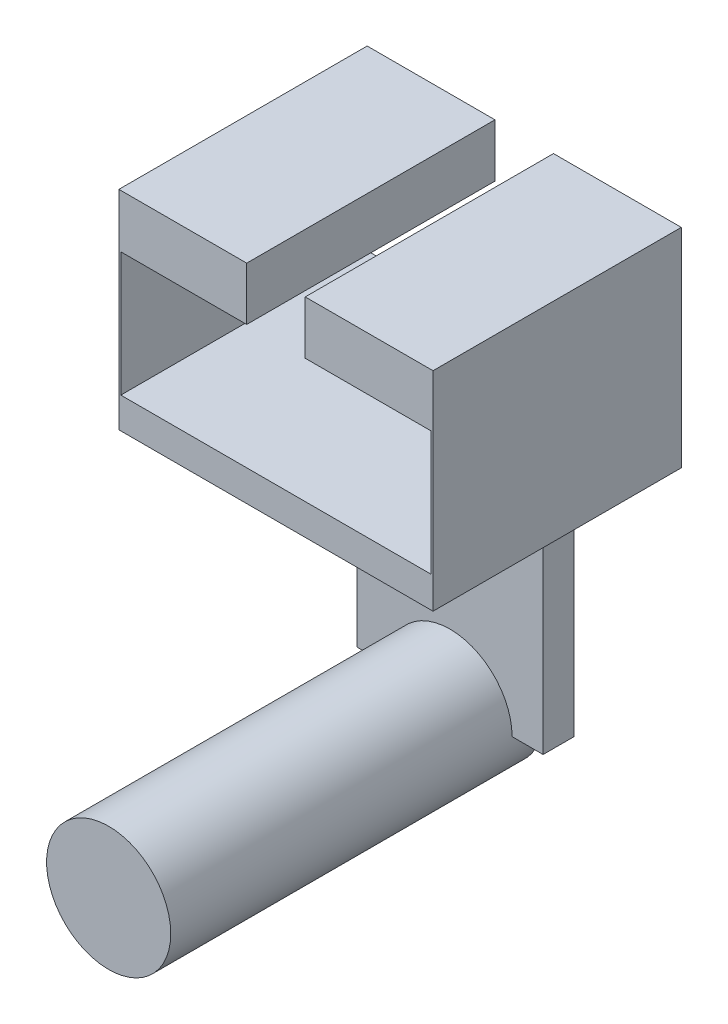
from build123d import *

# Parameters (mm, degrees)
SKETCH3_R            = 12.7
BOSS_EXTRUDE1_DEPTH  = 76.2
BOSS_EXTRUDE2_DEPTH  = 6.35
SKETCH6_W            = 63.5
SKETCH6_H            = 50.8
BOSS_EXTRUDE3_DEPTH  = 6.35
SKETCH9_W            = 50.8
SKETCH9_H            = 6.35
BOSS_EXTRUDE4_DEPTH  = 0.38862
SKETCH10_W           = 0.38862
SKETCH10_H           = 50.8
BOSS_EXTRUDE5_DEPTH  = 25.4
SKETCH11_W           = 50.8
SKETCH11_H           = 6.35
BOSS_EXTRUDE6_DEPTH  = 0.38862
SKETCH13_W           = 0.38862
SKETCH13_H           = 50.8
BOSS_EXTRUDE7_DEPTH  = 25.4
SKETCH14_W           = 0.38862
SKETCH14_H           = 50.8
BOSS_EXTRUDE8_DEPTH  = 10.8712
SKETCH15_W           = 50.8
SKETCH15_H           = 10.8712
BOSS_EXTRUDE9_DEPTH  = 25.76322
SKETCH16_W           = 0.38862
SKETCH16_H           = 50.8
BOSS_EXTRUDE10_DEPTH = 10.8712
SKETCH17_W           = 50.8
SKETCH17_H           = 10.8712
BOSS_EXTRUDE11_DEPTH = 25.76322


with BuildPart() as part:
    # Sketch3 → Boss-Extrude1 (new body)
    with BuildSketch(Plane.XY):
        with Locations(Location((0, 0, 0), (0, 0, 180))):
            Circle(SKETCH3_R)
    extrude(amount=BOSS_EXTRUDE1_DEPTH)

    # Sketch4 → Boss-Extrude2 (add)
    with BuildSketch(Plane(origin=(0, 0, 0), x_dir=(-1, 0, 0), z_dir=(0, 0, -1))):
        Polygon((0, 0), (19.05, 0), (19.05, 50.8), (-19.05, 50.8), (-19.05, 0), align=None)
    extrude(amount=-BOSS_EXTRUDE2_DEPTH)

    # Sketch6 → Boss-Extrude3 (add)
    with BuildSketch(Plane(origin=(0, 50.8, 0), x_dir=(1, 0, 0), z_dir=(0, 1, 0))):
        with Locations((1.04805825, -17.613482739)):
            Rectangle(SKETCH6_W, SKETCH6_H)
    extrude(amount=BOSS_EXTRUDE3_DEPTH)

    # Sketch9 → Boss-Extrude4 (add)
    with BuildSketch(Plane(origin=(32.79805825, 0, 0), x_dir=(0, 0, -1), z_dir=(1, 0, 0))):
        with Locations((-17.613482739, 53.975)):
            Rectangle(SKETCH9_W, SKETCH9_H)
    extrude(amount=BOSS_EXTRUDE4_DEPTH)

    # Sketch10 → Boss-Extrude5 (add)
    with BuildSketch(Plane(origin=(0, 57.15, 0), x_dir=(1, 0, 0), z_dir=(0, 1, 0))):
        with Locations((32.99236825, -17.613482739)):
            Rectangle(SKETCH10_W, SKETCH10_H)
    extrude(amount=BOSS_EXTRUDE5_DEPTH)

    # Sketch11 → Boss-Extrude6 (add)
    with BuildSketch(Plane.ZY.offset(30.70194175)):
        with Locations((17.613482739, 53.975)):
            Rectangle(SKETCH11_W, SKETCH11_H)
    extrude(amount=BOSS_EXTRUDE6_DEPTH)

    # Sketch13 → Boss-Extrude7 (add)
    with BuildSketch(Plane(origin=(0, 57.15, 0), x_dir=(1, 0, 0), z_dir=(0, 1, 0))):
        with Locations((-30.89625175, -17.613482739)):
            Rectangle(SKETCH13_W, SKETCH13_H)
    extrude(amount=BOSS_EXTRUDE7_DEPTH)

    # Sketch14 → Boss-Extrude8 (add)
    with BuildSketch(Plane(origin=(0, 82.55, 0), x_dir=(1, 0, 0), z_dir=(0, 1, 0))):
        with Locations((-30.89625175, -17.613482739)):
            Rectangle(SKETCH14_W, SKETCH14_H)
    extrude(amount=BOSS_EXTRUDE8_DEPTH)

    # Sketch15 → Boss-Extrude9 (add)
    with BuildSketch(Plane(origin=(-30.70194175, 0, 0), x_dir=(0, 0, -1), z_dir=(1, 0, 0))):
        with Locations((-17.613482739, 87.9856)):
            Rectangle(SKETCH15_W, SKETCH15_H)
    extrude(amount=BOSS_EXTRUDE9_DEPTH)

    # Sketch16 → Boss-Extrude10 (add)
    with BuildSketch(Plane(origin=(0, 82.55, 0), x_dir=(1, 0, 0), z_dir=(0, 1, 0))):
        with Locations((32.99236825, -17.613482739)):
            Rectangle(SKETCH16_W, SKETCH16_H)
    extrude(amount=BOSS_EXTRUDE10_DEPTH)

    # Sketch17 → Boss-Extrude11 (add)
    with BuildSketch(Plane.ZY.offset(-32.79805825)):
        with Locations((17.613482739, 87.9856)):
            Rectangle(SKETCH17_W, SKETCH17_H)
    extrude(amount=BOSS_EXTRUDE11_DEPTH)


solid = part.part
